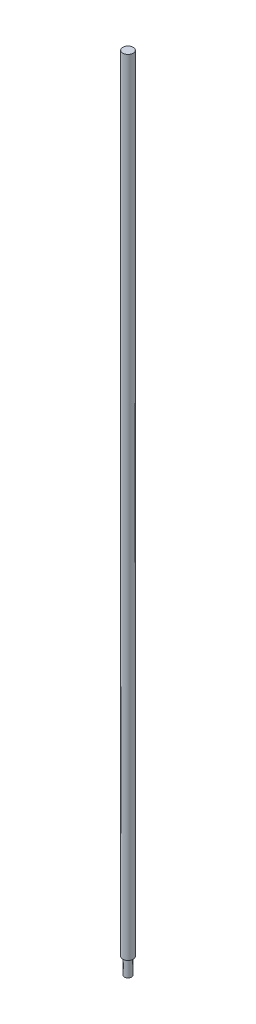
from build123d import *

# Parameters (mm, degrees)
SKETCH_1_R      = 3
EXTRUDE_1_DEPTH = 455
SKETCH_2_R      = 2
EXTRUDE_2_DEPTH = 9.5


with BuildPart() as part:
    # 草图1 → 凸台-拉伸1 (new body)
    with BuildSketch(Plane(origin=(0, 0, 0), x_dir=(1, 0, 0), z_dir=(0, 1, 0))):
        with Locations(Location((0, 0, 0), (0, 0, 90))):
            Circle(SKETCH_1_R)
    extrude(amount=EXTRUDE_1_DEPTH)

    # 草图2 → 凸台-拉伸2 (add)
    with BuildSketch(Plane.XZ):
        with Locations(Location((0, 0, 0), (0, 0, 90))):
            Circle(SKETCH_2_R)
    extrude(amount=EXTRUDE_2_DEPTH)


solid = part.part
